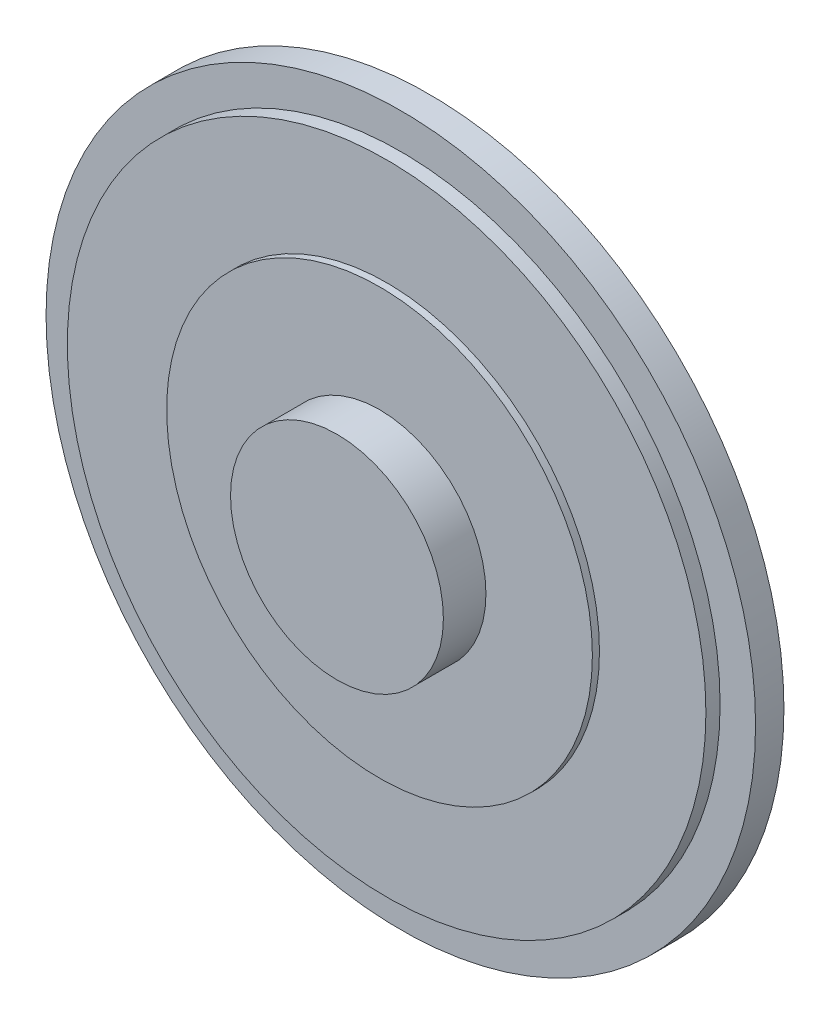
from build123d import *

# Parameters (mm, degrees)
SKETCH1_R           = 25
SKETCH1_R_2         = 22.5
SKETCH1_R_3         = 15
SKETCH1_R_4         = 7.5
BOSS_EXTRUDE1_DEPTH = 2
BOSS_EXTRUDE2_START = 2
SKETCH1_3_R         = 22.5
SKETCH1_3_R_2       = 15
SKETCH1_3_R_3       = 7.5
BOSS_EXTRUDE2_DEPTH = 1
BOSS_EXTRUDE3_START = 3
SKETCH1_4_R         = 15
SKETCH1_4_R_2       = 7.5
BOSS_EXTRUDE3_DEPTH = 0.5
BOSS_EXTRUDE4_START = 3.5
SKETCH1_5_R         = 7.5
BOSS_EXTRUDE4_DEPTH = 3


with BuildPart() as part:
    # Sketch1 → Boss-Extrude1 (new body)
    # profile 1 of 4: a face of its own
    with BuildSketch(Plane.XY):
        Circle(SKETCH1_R)
        Circle(SKETCH1_R_2, mode=Mode.SUBTRACT)
    # profile 2 of 4: a face of its own
    with BuildSketch(Plane.XY):
        Circle(SKETCH1_R_2)
        Circle(SKETCH1_R_3, mode=Mode.SUBTRACT)
    # profile 3 of 4: a face of its own
    with BuildSketch(Plane.XY):
        Circle(SKETCH1_R_3)
        Circle(SKETCH1_R_4, mode=Mode.SUBTRACT)
    # profile 4 of 4: a face of its own
    with BuildSketch(Plane.XY):
        Circle(SKETCH1_R_4)
    extrude(amount=BOSS_EXTRUDE1_DEPTH)

    # Sketch1<3> → Boss-Extrude2 (add)
    # profile 1 of 3: a face of its own
    with BuildSketch(Plane.XY.offset(BOSS_EXTRUDE2_START)):
        Circle(SKETCH1_3_R)
        Circle(SKETCH1_3_R_2, mode=Mode.SUBTRACT)
    # profile 2 of 3: a face of its own
    with BuildSketch(Plane.XY.offset(BOSS_EXTRUDE2_START)):
        Circle(SKETCH1_3_R_2)
        Circle(SKETCH1_3_R_3, mode=Mode.SUBTRACT)
    # profile 3 of 3: a face of its own
    with BuildSketch(Plane.XY.offset(BOSS_EXTRUDE2_START)):
        Circle(SKETCH1_3_R_3)
    extrude(amount=BOSS_EXTRUDE2_DEPTH)

    # Sketch1<4> → Boss-Extrude3 (add)
    # profile 1 of 2: a face of its own
    with BuildSketch(Plane.XY.offset(BOSS_EXTRUDE3_START)):
        Circle(SKETCH1_4_R)
        Circle(SKETCH1_4_R_2, mode=Mode.SUBTRACT)
    # profile 2 of 2: a face of its own
    with BuildSketch(Plane.XY.offset(BOSS_EXTRUDE3_START)):
        Circle(SKETCH1_4_R_2)
    extrude(amount=BOSS_EXTRUDE3_DEPTH)

    # Sketch1<5> → Boss-Extrude4 (add)
    with BuildSketch(Plane.XY.offset(BOSS_EXTRUDE4_START)):
        Circle(SKETCH1_5_R)
    extrude(amount=BOSS_EXTRUDE4_DEPTH)


solid = part.part
